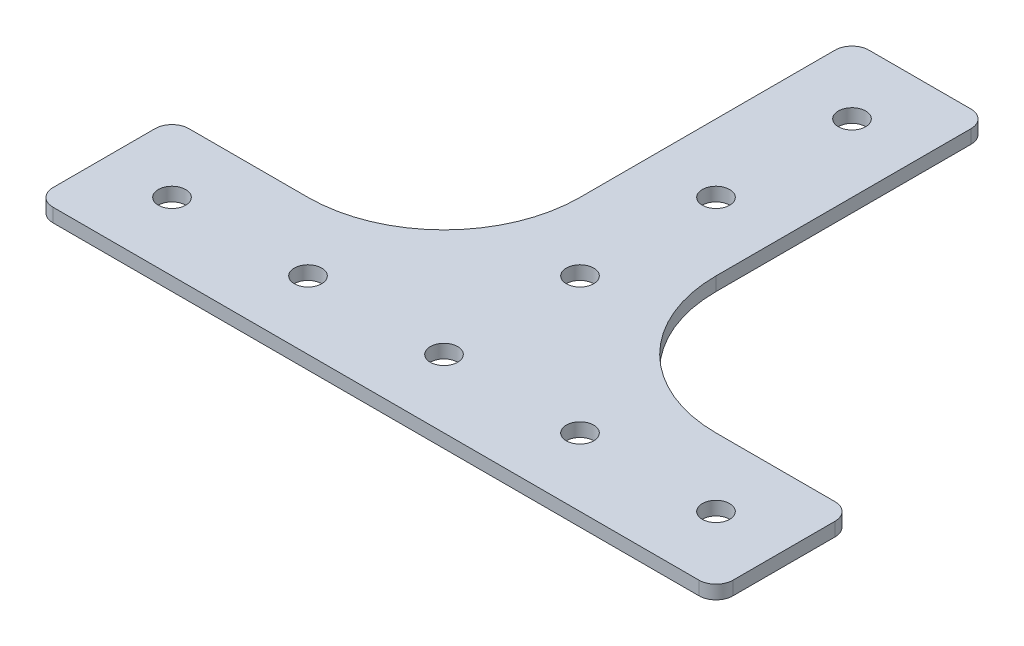
from build123d import *

# Parameters (mm, degrees)
BOSS_EXTRUDE1_DEPTH        = 2.54
FILLET1_R                  = 3.175
F_7_0_201_DIAMETER_HOLE1_D = 5.1054
FILLET2_R                  = 25.4


with BuildPart() as part:
    # Sketch1 → Boss-Extrude1 (new body)
    with BuildSketch(Plane(origin=(0, 0, 0), x_dir=(1, 0, 0), z_dir=(0, 1, 0))):
        Polygon((-63.5, 0), (63.5, 0), (63.5, 25.4), (12.7, 25.4), (12.7, 101.6), (-12.7, 101.6), (-12.7, 25.4), (-63.5, 25.4), align=None)
    extrude(amount=BOSS_EXTRUDE1_DEPTH)

    # Fillet1
    fillet1_edges = [part.edges().sort_by_distance(p)[0] for p in [
        (-12.7, 1.27, -101.6),
        (12.7, 1.27, -101.6),
        (63.5, 1.27, -25.4),
        (63.5, 1.27, 0),
        (-63.5, 1.27, 0),
        (-63.5, 1.27, -25.4),
    ]]
    fillet(fillet1_edges, radius=FILLET1_R)

    # #7 (0.201) Diameter Hole1 (through all)
    with Locations(Plane(origin=(0, 2.54, 0), x_dir=(1, 0, 0), z_dir=(0, 1, 0))):
        with Locations((0, 12.7), (25.4, 12.7), (50.8, 12.7), (-25.4, 12.7), (-50.8, 12.7), (0, 38.1), (0, 63.5), (0, 88.9)):
            Hole(F_7_0_201_DIAMETER_HOLE1_D / 2)

    # Fillet2
    fillet2_edges = [part.edges().sort_by_distance(p)[0] for p in [
        (12.7, 1.27, -25.4),
        (-12.7, 1.27, -25.4),
    ]]
    fillet(fillet2_edges, radius=FILLET2_R)


solid = part.part
